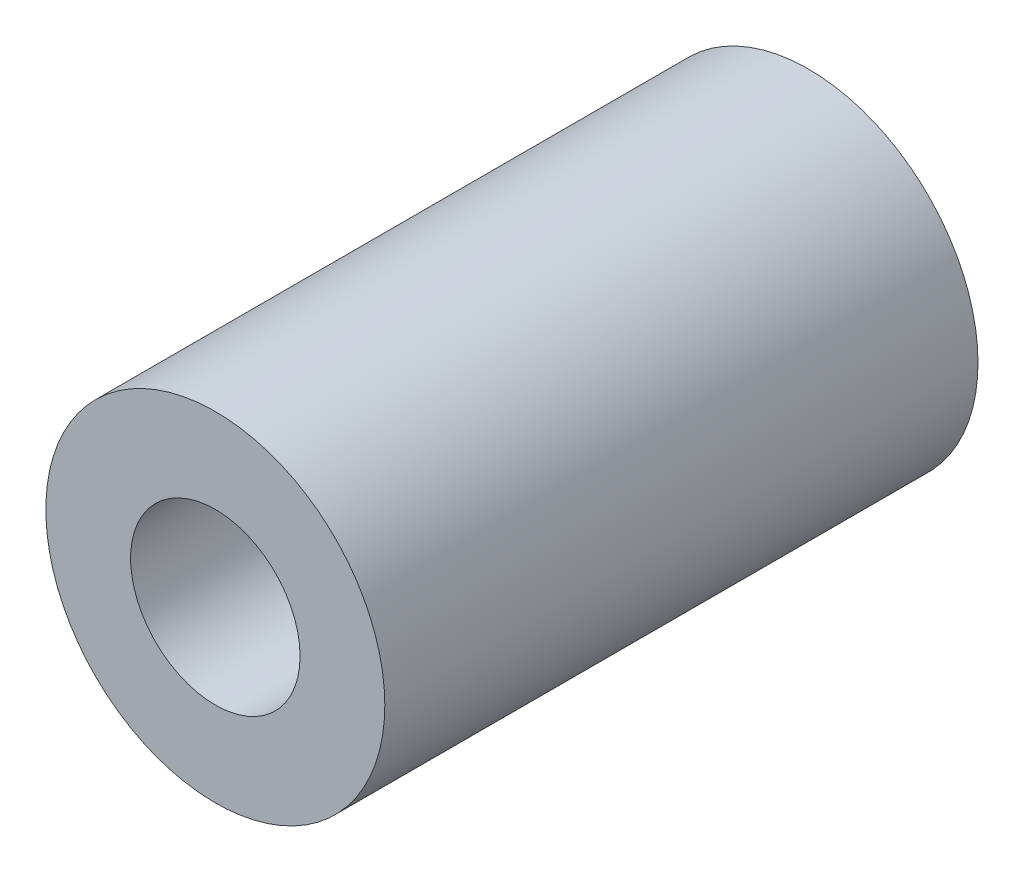
from build123d import *

# Parameters (mm, degrees)
BEARINGSKE_R   = 1
BEARINGSKE_R_2 = 0.5
BEARING_DEPTH  = 3.5


with BuildPart() as part:
    # BearingSke → Bearing (new body)
    with BuildSketch(Plane.XY):
        Circle(BEARINGSKE_R)
        Circle(BEARINGSKE_R_2, mode=Mode.SUBTRACT)
    extrude(amount=BEARING_DEPTH)


solid = part.part
